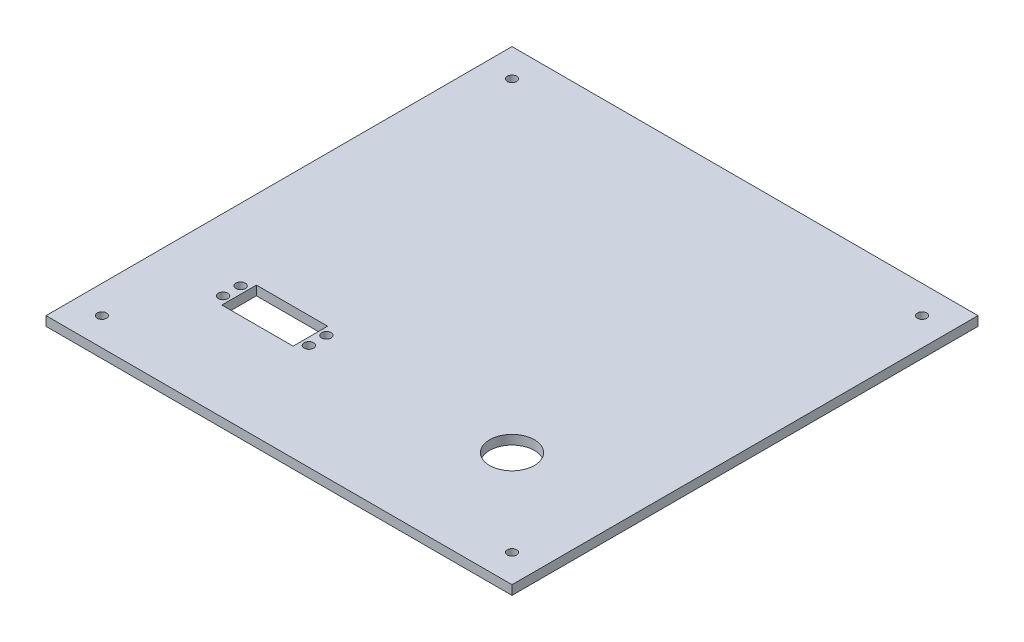
from build123d import *

# Parameters (mm, degrees)
SCHIZZO1_W                   = 250
SCHIZZO1_H                   = 250
SCHIZZO1_R                   = 2.5
SCHIZZO1_R_2                 = 12
SCHIZZO1_R_3                 = 2.54
SCHIZZO1_W_2                 = 38.23
SCHIZZO1_H_2                 = 18.54
ESTRUSIONE_ESTRUSIONE1_DEPTH = 5


with BuildPart() as part:
    # Schizzo1 → Estrusione-Estrusione1 (new body)
    with BuildSketch(Plane(origin=(0, 0, 0), x_dir=(1, 0, 0), z_dir=(0, 1, 0))):
        Rectangle(SCHIZZO1_W, SCHIZZO1_H)
        with Locations(Location((-110, 110, 0), (0, 0, 270))):
            Circle(SCHIZZO1_R, mode=Mode.SUBTRACT)
        with Locations(Location((110, 110, 0), (0, 0, 270))):
            Circle(SCHIZZO1_R, mode=Mode.SUBTRACT)
        with Locations(Location((-110, -110, 0), (0, 0, 270))):
            Circle(SCHIZZO1_R, mode=Mode.SUBTRACT)
        with Locations(Location((110, -110, 0), (0, 0, 270))):
            Circle(SCHIZZO1_R, mode=Mode.SUBTRACT)
        with Locations(Location((63.639610307, -63.639610307, 0), (0, 0, 270))):
            Circle(SCHIZZO1_R_2, mode=Mode.SUBTRACT)
        with Locations(Location((-86.655104778, -58.939610307, 0), (0, 0, 270))):
            Circle(SCHIZZO1_R_3, mode=Mode.SUBTRACT)
        with Locations(Location((-86.655104778, -68.337610307, 0), (0, 0, 270))):
            Circle(SCHIZZO1_R_3, mode=Mode.SUBTRACT)
        with Locations(Location((-40.621115836, -68.337610307, 0), (0, 0, 270))):
            Circle(SCHIZZO1_R_3, mode=Mode.SUBTRACT)
        with Locations(Location((-40.621115836, -58.939610307, 0), (0, 0, 270))):
            Circle(SCHIZZO1_R_3, mode=Mode.SUBTRACT)
        with Locations((-63.639610307, -63.639610307)):
            Rectangle(SCHIZZO1_W_2, SCHIZZO1_H_2, mode=Mode.SUBTRACT)
    extrude(amount=ESTRUSIONE_ESTRUSIONE1_DEPTH)


solid = part.part
